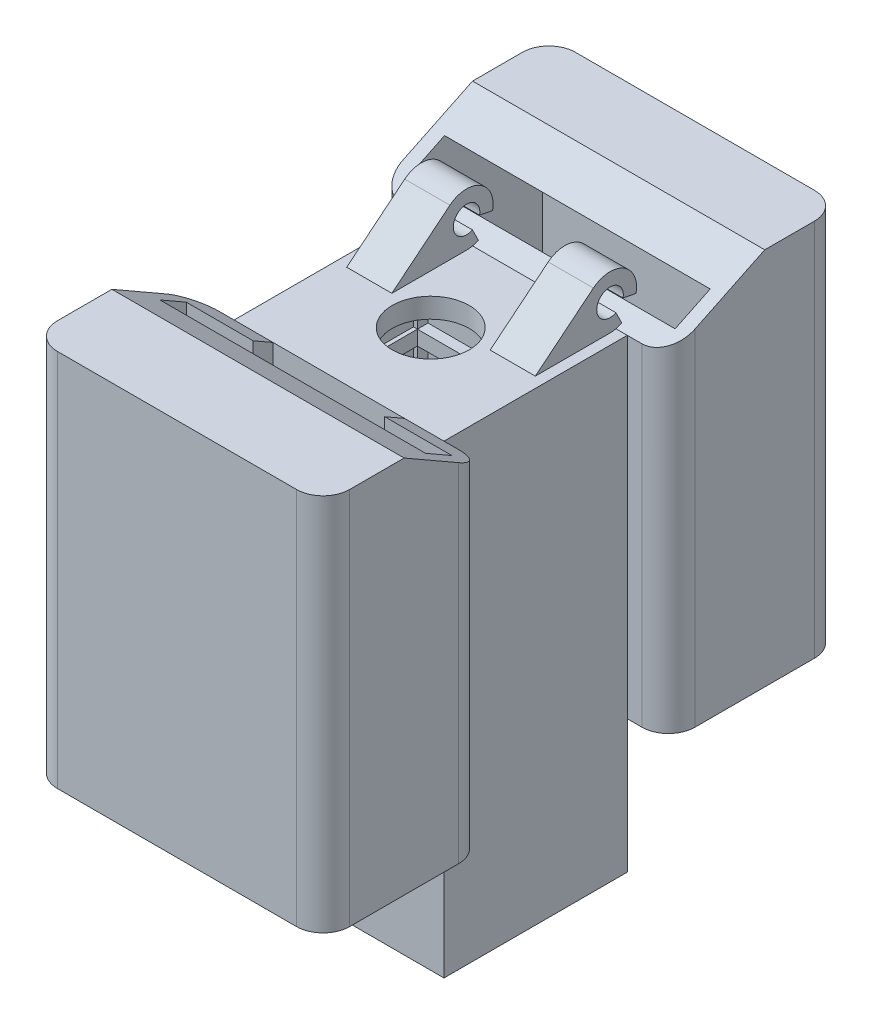
from build123d import *

# Parameters (mm, degrees)
SKETCH_1_W               = 12.8
SKETCH_1_H               = 10.8
EXTRUDE_1_DEPTH          = 1.5
CUT_EXTRUDE_1_REACH      = 13.721
SKETCH_2_R               = 2.9
SKETCH_3_W               = 12.8
SKETCH_3_H               = 1.5
EXTRUDE_2_DEPTH          = 35
SKETCH_6_W               = 12.8
SKETCH_6_H               = 1.5
CUT_EXTRUDE_2_DEPTH      = 10
EXTRUDE_4_DEPTH          = 15.8
CUT_EXTRUDE_3_DEPTH      = 38.580939349
CUT_EXTRUDE_3_DEPTH_BACK = 38.580939349
SKETCH_10_W              = 7.4
SKETCH_10_H              = 4
SKETCH_10_W_2            = 0.8
EXTRUDE_5_DEPTH          = 3.1
EXTRUDE_5_DEPTH_BACK     = 18.9
SKETCH_18_W              = 20
SKETCH_18_H              = 10
CUT_EXTRUDE_4_DEPTH      = 27
CUT_EXTRUDE_5_REACH      = 40.777
SKETCH_20_W              = 12.8
SKETCH_20_H              = 11.75
FILLET_3_R               = 2
SKETCH_21_W              = 12.8
SKETCH_21_H              = 33.5
EXTRUDE_6_DEPTH          = 0.8
SKETCH_22_W              = 12.8
SKETCH_22_H              = 10
CUT_EXTRUDE_6_DEPTH      = 0.8
SKETCH_23_W              = 12.8
SKETCH_23_H              = 2
CUT_EXTRUDE_7_DEPTH      = 0.8
SKETCH_25_W              = 12.8
SKETCH_25_H              = 2
CUT_EXTRUDE_8_DEPTH      = 0.8
SKETCH_26_W              = 12.8
SKETCH_26_H              = 2
CUT_EXTRUDE_9_DEPTH      = 0.8
SKETCH_27_W              = 12.8
SKETCH_27_H              = 2
CUT_EXTRUDE_10_DEPTH     = 0.8
SKETCH_28_W              = 10
SKETCH_28_H              = 2
CUT_EXTRUDE_11_DEPTH     = 0.3
SKETCH_29_W              = 10
SKETCH_29_H              = 2
CUT_EXTRUDE_12_DEPTH     = 0.3
SKETCH_30_W              = 22
SKETCH_30_H              = 28.5
EXTRUDE_7_DEPTH          = 12.2
SKETCH_32_W              = 20
SKETCH_32_H              = 9.2
CUT_EXTRUDE_13_DEPTH     = 27
CUT_EXTRUDE_14_DEPTH     = 46.551260858
SKETCH_34_W              = 9.9
SKETCH_34_H              = 1.5
CUT_EXTRUDE_15_DEPTH     = 39.481186787
FILLET_4_R               = 2
SKETCH_36_W              = 12.3
SKETCH_36_H              = 2
CUT_EXTRUDE_18_DEPTH     = 1
SKETCH_37_W              = 12.3
SKETCH_37_H              = 2
CUT_EXTRUDE_19_DEPTH     = 1


with BuildPart() as part:
    # 草图1 → 凸台-拉伸1 (new body)
    with BuildSketch(Plane(origin=(0, 0, 0), x_dir=(1, 0, 0), z_dir=(0, 1, 0))):
        with Locations((2.081833616, -2.548726655)):
            Rectangle(SKETCH_1_W, SKETCH_1_H)
    extrude(amount=EXTRUDE_1_DEPTH)

    # 草图2 → 切除-拉伸1 (cut, up to next)
    with BuildSketch(Plane(origin=(0, 1.5, 0), x_dir=(1, 0, 0), z_dir=(0, 1, 0)), mode=Mode.PRIVATE) as cut_extrude_1_sk1:
        with Locations(Location((2.081833616, -2.548726655, 0), (0, 0, 270))):
            Circle(SKETCH_2_R)
    cut_extrude_1_tool1 = extrude(cut_extrude_1_sk1.sketch, amount=-CUT_EXTRUDE_1_REACH, mode=Mode.PRIVATE) & part.part
    add(cut_extrude_1_tool1.solids().sort_by_distance((2.081834, 1.5, 2.548727))[0], mode=Mode.SUBTRACT)

    # 草图3 → 凸台-拉伸2 (add)
    with BuildSketch(Plane(origin=(0, 1.5, 0), x_dir=(1, 0, 0), z_dir=(0, 1, 0))):
        Polygon((-4.318166384, 4.351273345), (-5.818166384, 4.351273345), (-5.818166384, -9.448726655), (-4.318166384, -9.448726655), (-4.318166384, -7.948726655), (-4.318166384, 2.851273345), align=None)
        with Locations((2.081833616, 3.601273345)):
            Rectangle(SKETCH_3_W, SKETCH_3_H)
        Polygon((8.481833616, 4.351273345), (9.981833616, 4.351273345), (9.981833616, -9.448726655), (8.481833616, -9.448726655), (8.481833616, -7.948726655), (8.481833616, 2.851273345), align=None)
        with Locations((2.081833616, -8.698726655)):
            Rectangle(SKETCH_3_W, SKETCH_3_H)
    extrude(amount=-EXTRUDE_2_DEPTH)

    # 草图6 → 切除-拉伸2 (cut)
    with BuildSketch(Plane.XZ.offset(33.5)):
        with Locations((2.081833616, -3.601273345)):
            Rectangle(SKETCH_6_W, SKETCH_6_H)
    extrude(amount=-CUT_EXTRUDE_2_DEPTH, mode=Mode.SUBTRACT)

    # 草图9 → 凸台-拉伸4 (add)
    with BuildSketch(Plane(origin=(9.981833616, 0, 0), x_dir=(0, 0, -1), z_dir=(1, 0, 0))):
        with BuildLine():
            Line((4.294951619, 2.603813865), (4.738629893, 1.70762773))
            ThreePointArc((4.738629893, 1.70762773), (4.306935204, 1.552598585), (3.851273345, 1.5))
            Line((3.851273345, 1.5), (-1.771682581, 1.5))
            Line((-1.771682581, 1.5), (2.59831793, 5.058878677))
            ThreePointArc((2.59831793, 5.058878677), (4.892528233, 5.207567937), (5.810847908, 3.099915598))
            Line((5.810847908, 3.099915598), (4.830532954, 3.297390482))
            ThreePointArc((4.830532954, 3.297390482), (3.059787283, 4.111187217), (4.294951619, 2.603813865))
        make_face()
    extrude(amount=-EXTRUDE_4_DEPTH)

    # 草图10 → 切除-拉伸3 (cut, two sides: drawn at the far end of the back side and taken through both)
    with BuildSketch(Plane(origin=(0, 0, -4.351273345), x_dir=(-1, 0, 0), z_dir=(0, 0, -1)).offset(-CUT_EXTRUDE_3_DEPTH_BACK)):
        with Locations((-2.081833616, 3.5)):
            Rectangle(SKETCH_10_W, SKETCH_10_H)
        with Locations((5.418166384, 3.5)):
            Rectangle(SKETCH_10_W_2, SKETCH_10_H)
        with Locations((-9.581833616, 3.5)):
            Rectangle(SKETCH_10_W_2, SKETCH_10_H)
    extrude(amount=CUT_EXTRUDE_3_DEPTH + CUT_EXTRUDE_3_DEPTH_BACK, mode=Mode.SUBTRACT)

    # 草图17 → 凸台-拉伸5 (add, two sides: drawn at the far end of the back side and taken through both)
    with BuildSketch(Plane.ZY.offset(5.818166384).offset(-EXTRUDE_5_DEPTH_BACK)):
        Polygon((-4.351273345, -23.5), (-17.351273345, -23.5), (-17.351273345, 5), (-11.601273345, 5), (-4.351273345, 1.5), align=None)
    extrude(amount=EXTRUDE_5_DEPTH + EXTRUDE_5_DEPTH_BACK)

    # 草图18 → 切除-拉伸4 (cut)
    with BuildSketch(Plane.XZ.offset(23.5)):
        with Locations((2.081833616, -10.851273345)):
            Rectangle(SKETCH_18_W, SKETCH_18_H)
    extrude(amount=-CUT_EXTRUDE_4_DEPTH, mode=Mode.SUBTRACT)

    # 草图20 → 切除-拉伸5 (cut, up to next)
    with BuildSketch(Plane.XY.offset(-2.851273345), mode=Mode.PRIVATE) as cut_extrude_5_sk1:
        with Locations((2.081833616, -17.625)):
            Rectangle(SKETCH_20_W, SKETCH_20_H)
    cut_extrude_5_tool1 = extrude(cut_extrude_5_sk1.sketch, amount=-CUT_EXTRUDE_5_REACH, mode=Mode.PRIVATE) & part.part
    add(cut_extrude_5_tool1.solids().sort_by_distance((2.081834, -17.625, -2.851273))[0], mode=Mode.SUBTRACT)

    # 圆角3
    fillet_3_edges = [part.edges().sort_by_distance(p)[0] for p in [
        (13.081833616, -11, -4.351273345),
        (13.081833616, -9.25, -17.351273345),
        (-8.918166384, -11, -4.351273345),
        (-8.918166384, -9.25, -17.351273345),
    ]]
    fillet(fillet_3_edges, radius=FILLET_3_R)

    # 草图21 → 凸台-拉伸6 (add)
    with BuildSketch(Plane(origin=(0, 0, 7.948726655), x_dir=(-1, 0, 0), z_dir=(0, 0, -1))):
        with Locations((-2.081833616, -16.75)):
            Rectangle(SKETCH_21_W, SKETCH_21_H)
    extrude(amount=EXTRUDE_6_DEPTH)

    # 草图22 → 切除-拉伸6 (cut)
    with BuildSketch(Plane(origin=(0, 0, 7.148726655), x_dir=(-1, 0, 0), z_dir=(0, 0, -1))):
        with Locations((-2.081833616, -28.5)):
            Rectangle(SKETCH_22_W, SKETCH_22_H)
    extrude(amount=-CUT_EXTRUDE_6_DEPTH, mode=Mode.SUBTRACT)

    # 草图23 → 切除-拉伸7 (cut)
    with BuildSketch(Plane(origin=(0, 0, 7.148726655), x_dir=(-1, 0, 0), z_dir=(0, 0, -1))):
        with Locations((-2.081833616, -3.5)):
            Rectangle(SKETCH_23_W, SKETCH_23_H)
    extrude(amount=-CUT_EXTRUDE_7_DEPTH, mode=Mode.SUBTRACT)

    # 草图25 → 切除-拉伸8 (cut)
    with BuildSketch(Plane.XY.offset(-2.851273345)):
        with Locations((2.081833616, -3.5)):
            Rectangle(SKETCH_25_W, SKETCH_25_H)
    extrude(amount=-CUT_EXTRUDE_8_DEPTH, mode=Mode.SUBTRACT)

    # 草图26 → 切除-拉伸9 (cut)
    with BuildSketch(Plane(origin=(0, 0, 7.148726655), x_dir=(-1, 0, 0), z_dir=(0, 0, -1))):
        with Locations((-2.081833616, -6.6)):
            Rectangle(SKETCH_26_W, SKETCH_26_H)
    extrude(amount=-CUT_EXTRUDE_9_DEPTH, mode=Mode.SUBTRACT)

    # 草图27 → 切除-拉伸10 (cut)
    with BuildSketch(Plane.XY.offset(-2.851273345)):
        with Locations((2.081833616, -6.6)):
            Rectangle(SKETCH_27_W, SKETCH_27_H)
    extrude(amount=-CUT_EXTRUDE_10_DEPTH, mode=Mode.SUBTRACT)

    # 草图28 → 切除-拉伸11 (cut)
    with BuildSketch(Plane(origin=(-4.318166384, 0, 0), x_dir=(0, 0, -1), z_dir=(1, 0, 0))):
        with Locations((-2.148726655, -6.6)):
            Rectangle(SKETCH_28_W, SKETCH_28_H)
        with Locations((-2.148726655, -3.5)):
            Rectangle(SKETCH_28_W, SKETCH_28_H)
    extrude(amount=-CUT_EXTRUDE_11_DEPTH, mode=Mode.SUBTRACT)

    # 草图29 → 切除-拉伸12 (cut)
    with BuildSketch(Plane.ZY.offset(-8.481833616)):
        with Locations((2.148726655, -3.5)):
            Rectangle(SKETCH_29_W, SKETCH_29_H)
        with Locations((2.148726655, -6.6)):
            Rectangle(SKETCH_29_W, SKETCH_29_H)
    extrude(amount=-CUT_EXTRUDE_12_DEPTH, mode=Mode.SUBTRACT)

    # 草图30 → 凸台-拉伸7 (add)
    with BuildSketch(Plane.XY.offset(9.448726655)):
        with Locations((2.081833616, -9.25)):
            Rectangle(SKETCH_30_W, SKETCH_30_H)
    extrude(amount=EXTRUDE_7_DEPTH)

    # 草图32 → 切除-拉伸13 (cut)
    with BuildSketch(Plane.XZ.offset(23.5)):
        with Locations((2.081833616, 15.548726655)):
            Rectangle(SKETCH_32_W, SKETCH_32_H)
    extrude(amount=-CUT_EXTRUDE_13_DEPTH, mode=Mode.SUBTRACT)

    # 草图33 → 切除-拉伸14 (cut, through all)
    with BuildSketch(Plane(origin=(13.081833616, 0, 0), x_dir=(0, 0, -1), z_dir=(1, 0, 0))):
        Polygon((-15.548726655, 5), (-9.448726655, 1.5), (-9.448726655, 5), align=None)
    extrude(amount=-CUT_EXTRUDE_14_DEPTH, mode=Mode.SUBTRACT)

    # 草图34 → 切除-拉伸15 (cut, through all)
    with BuildSketch(Plane.XZ.offset(23.5)):
        with Locations((2.065568836, 10.198726655)):
            Rectangle(SKETCH_34_W, SKETCH_34_H)
    extrude(amount=-CUT_EXTRUDE_15_DEPTH, mode=Mode.SUBTRACT)

    # 圆角4
    fillet_4_edges = [part.edges().sort_by_distance(p)[0] for p in [
        (13.081833616, -11, 9.448726655),
        (-8.918166384, -9.25, 21.648726655),
        (13.081833616, -9.25, 21.648726655),
        (-8.918166384, -11, 9.448726655),
    ]]
    fillet(fillet_4_edges, radius=FILLET_4_R)

    # 草图36 → 切除-拉伸18 (cut)
    with BuildSketch(Plane(origin=(-4.318166384, 0, 0), x_dir=(0, 0, -1), z_dir=(1, 0, 0))):
        with Locations((-1.798726655, -30.5)):
            Rectangle(SKETCH_36_W, SKETCH_36_H)
    extrude(amount=-CUT_EXTRUDE_18_DEPTH, mode=Mode.SUBTRACT)

    # 草图37 → 切除-拉伸19 (cut)
    with BuildSketch(Plane.ZY.offset(-8.481833616)):
        with Locations((1.798726655, -30.5)):
            Rectangle(SKETCH_37_W, SKETCH_37_H)
    extrude(amount=-CUT_EXTRUDE_19_DEPTH, mode=Mode.SUBTRACT)


solid = part.part
